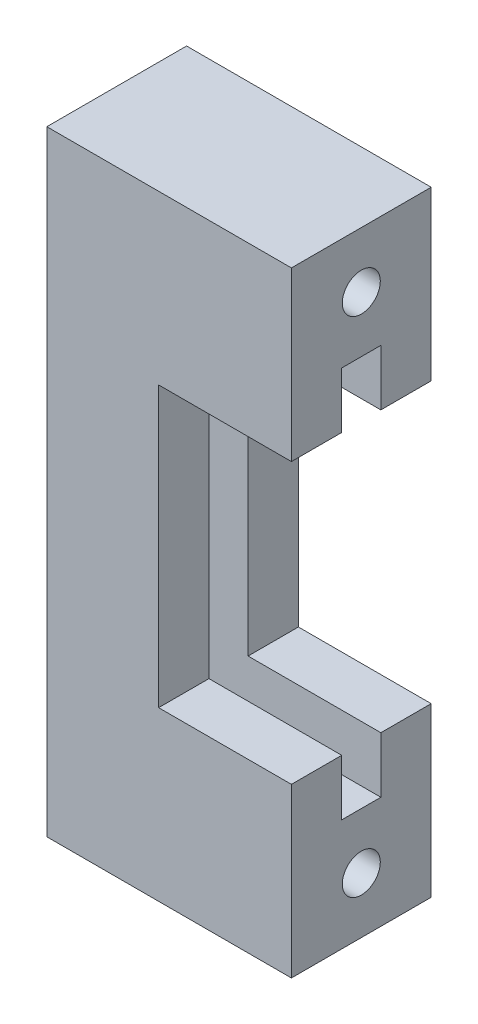
from build123d import *

# Parameters (mm, degrees)
SKETCH2_W           = 45.72
SKETCH2_H           = 55.88
SKETCH2_W_2         = 35.56
SKETCH2_H_2         = 35.56
BOSS_EXTRUDE1_DEPTH = 12.7
SKETCH3_W           = 35.56
SKETCH3_H           = 35.56
BOSS_EXTRUDE2_DEPTH = 4.572
SKETCH4_W           = 35.56
SKETCH4_H           = 35.56
BOSS_EXTRUDE3_DEPTH = 4.572
SKETCH5_W           = 25.4
SKETCH5_H           = 25.4
CUT_EXTRUDE1_DEPTH  = 74.308818023
SKETCH6_R           = 1.7272
CUT_EXTRUDE2_DEPTH  = 74.308818023
SKETCH7_R           = 1.7272
CUT_EXTRUDE3_DEPTH  = 74.308818023
SKETCH8_W           = 1.27
SKETCH8_H           = 55.88
CUT_EXTRUDE4_DEPTH  = 74.308818023


with BuildPart() as part:
    # Sketch2 → Boss-Extrude1 (new body)
    with BuildSketch(Plane.XY):
        with Locations((-22.86, 27.94)):
            Rectangle(SKETCH2_W, SKETCH2_H)
        with Locations((-22.86, 27.94)):
            Rectangle(SKETCH2_W_2, SKETCH2_H_2, mode=Mode.SUBTRACT)
    extrude(amount=BOSS_EXTRUDE1_DEPTH)

    # Sketch3 → Boss-Extrude2 (add)
    with BuildSketch(Plane.XY):
        with Locations((-22.86, 27.94)):
            Rectangle(SKETCH3_W, SKETCH3_H)
    extrude(amount=BOSS_EXTRUDE2_DEPTH)

    # Sketch4 → Boss-Extrude3 (add)
    with BuildSketch(Plane.XY.offset(12.7)):
        with Locations((-22.86, 27.94)):
            Rectangle(SKETCH4_W, SKETCH4_H)
    extrude(amount=-BOSS_EXTRUDE3_DEPTH)

    # Sketch5 → Cut-Extrude1 (cut, through all)
    with BuildSketch(Plane.XY.offset(12.7)):
        with Locations((-22.86, 27.94)):
            Rectangle(SKETCH5_W, SKETCH5_H)
    extrude(amount=-CUT_EXTRUDE1_DEPTH, mode=Mode.SUBTRACT)

    # Sketch6 → Cut-Extrude2 (cut, through all)
    with BuildSketch(Plane.ZY.offset(45.72)):
        with Locations(Location((6.35, 50.8, 0), (0, 0, 270))):
            Circle(SKETCH6_R)
    extrude(amount=-CUT_EXTRUDE2_DEPTH, mode=Mode.SUBTRACT)

    # Sketch7 → Cut-Extrude3 (cut, through all)
    with BuildSketch(Plane.ZY.offset(45.72)):
        with Locations(Location((6.35, 5.08, 0), (0, 0, 270))):
            Circle(SKETCH7_R)
    extrude(amount=-CUT_EXTRUDE3_DEPTH, mode=Mode.SUBTRACT)

    # Sketch8 → Cut-Extrude4 (cut, through all)
    with BuildSketch(Plane.XY.offset(12.7)):
        with Locations((-22.86, 27.94)):
            Rectangle(SKETCH8_W, SKETCH8_H)
    extrude(amount=-CUT_EXTRUDE4_DEPTH, mode=Mode.SUBTRACT)


with BuildPart() as body_2:
    # of the pieces the cut leaves, the one that is kept (cut_extrude4_keep)
    add(part.part.solids().sort_by_distance((-45.72, 55.88, 0))[0])


solid = body_2.part
